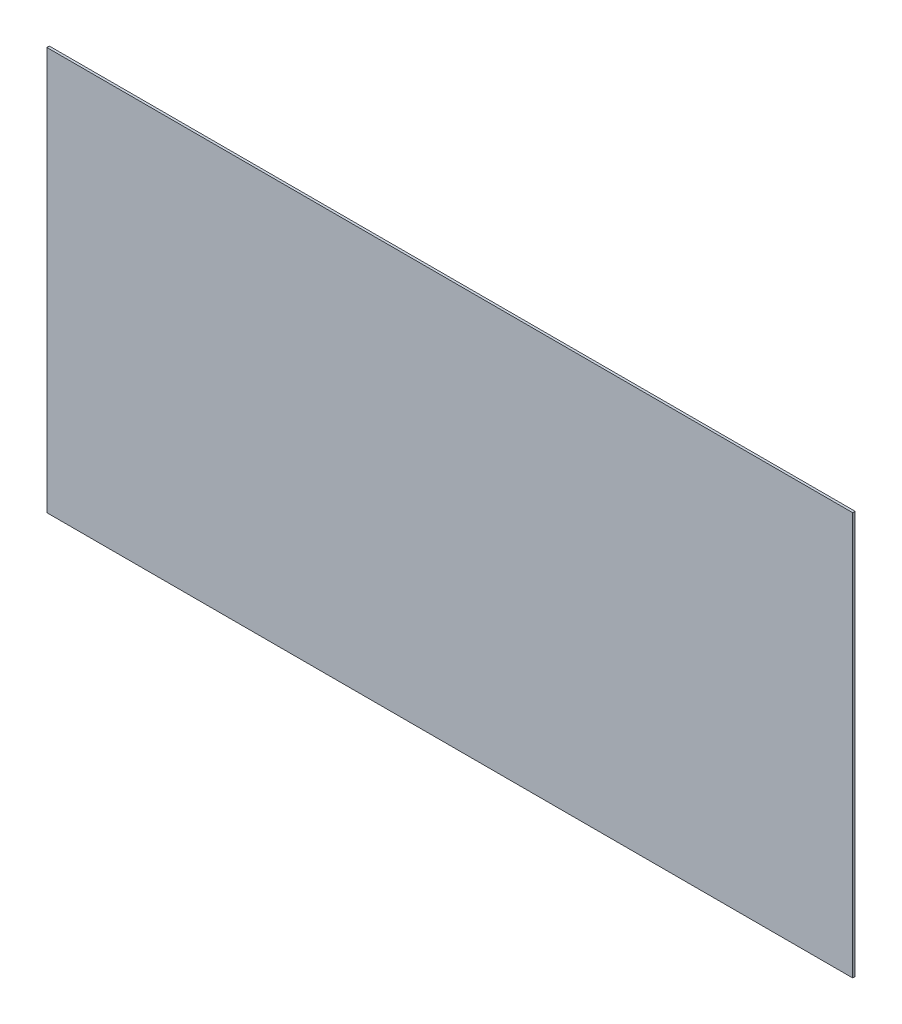
from build123d import *

# Parameters (mm, degrees)
SKETCH1_W           = 1828.8
SKETCH1_H           = 914.4
BOSS_EXTRUDE1_DEPTH = 5.588


with BuildPart() as part:
    # Sketch1 → Boss-Extrude1 (new body)
    with BuildSketch(Plane.XY):
        Rectangle(SKETCH1_W, SKETCH1_H)
    extrude(amount=BOSS_EXTRUDE1_DEPTH)


solid = part.part
